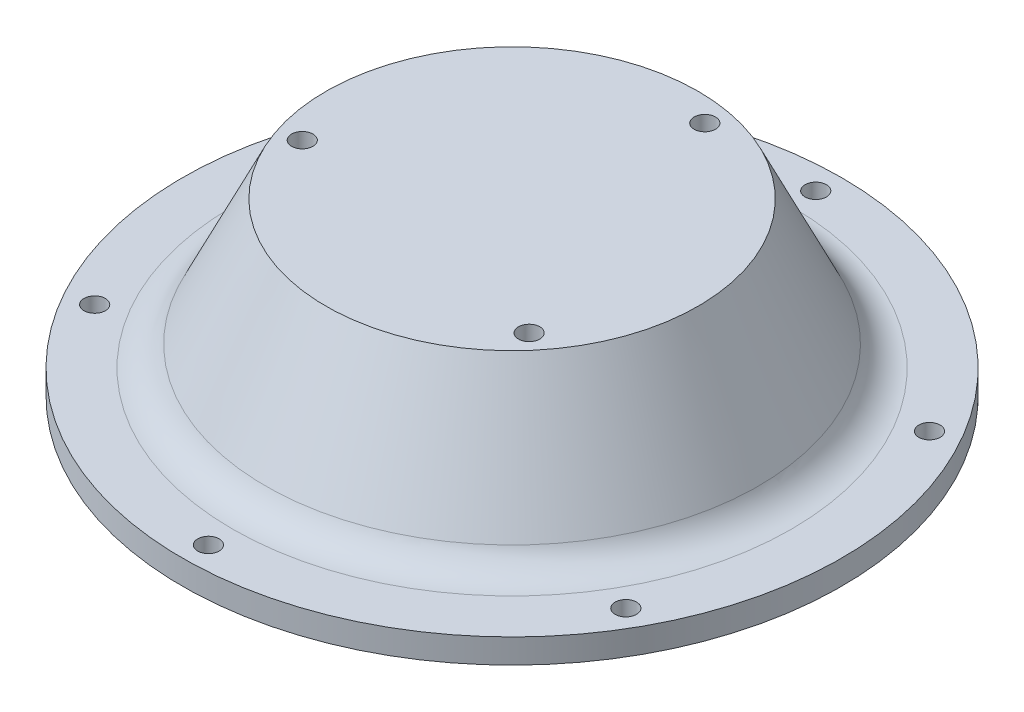
from build123d import *

# Parameters (mm, degrees)
SKETCH4_R           = 54
BOSS_EXTRUDE1_DEPTH = 4
FILLET1_R           = 6
SKETCH9_R           = 1.75
CUT_EXTRUDE2_DEPTH  = 50
SKETCH7_R           = 1.75
CUT_EXTRUDE3_DEPTH  = 50


with BuildPart() as part:
    # Sketch2 → Revolve2 (revolve)
    with BuildSketch(Plane.XY, mode=Mode.PRIVATE) as revolve2_sk:
        Polygon((0, 0), (42, 0), (42, 24), (11.5, 24), align=None)
    revolve(revolve2_sk.sketch.rotate(Axis((42, 0, 0), (0, 1, 0)), 270), axis=Axis((42, 0, 0), (0, 1, 0)))

    # Sketch4 → Boss-Extrude1 (add)
    with BuildSketch(Plane.XZ):
        with Locations(Location((42, 0, 0), (0, 0, 270))):
            Circle(SKETCH4_R)
    extrude(amount=BOSS_EXTRUDE1_DEPTH)

    # Fillet1
    fillet1_edges = [part.edges().sort_by_distance(p)[0] for p in [
        (42, 0, 42),
    ]]
    fillet(fillet1_edges, radius=FILLET1_R)

    # Sketch9 → Cut-Extrude2 (cut)
    with BuildSketch(Plane(origin=(0, 24, 0), x_dir=(1, 0, 0), z_dir=(0, 1, 0))):
        with Locations(Location((47.059526539, 26.521711694, 0), (0, 0, 270))):
            Circle(SKETCH9_R)
        with Locations(Location((62.43871281, -17.642534361, 0), (0, 0, 270))):
            Circle(SKETCH9_R)
        with Locations(Location((16.501760651, -8.879177334, 0), (0, 0, 270))):
            Circle(SKETCH9_R)
    extrude(amount=-CUT_EXTRUDE2_DEPTH, mode=Mode.SUBTRACT)

    # Sketch7 → Cut-Extrude3 (cut)
    with BuildSketch(Plane(origin=(0, 0, 0), x_dir=(1, 0, 0), z_dir=(0, 1, 0))):
        with Locations(Location((42.246934907, -49.999390228, 0), (0, 0, 270))):
            Circle(SKETCH7_R)
        with Locations(Location((-1.177274657, -25.213547017, 0), (0, 0, 270))):
            Circle(SKETCH7_R)
        with Locations(Location((-1.424209565, 24.785843211, 0), (0, 0, 270))):
            Circle(SKETCH7_R)
        with Locations(Location((41.753065093, 49.999390228, 0), (0, 0, 270))):
            Circle(SKETCH7_R)
        with Locations(Location((85.177274657, 25.213547017, 0), (0, 0, 270))):
            Circle(SKETCH7_R)
        with Locations(Location((85.424209565, -24.785843211, 0), (0, 0, 270))):
            Circle(SKETCH7_R)
    extrude(amount=-CUT_EXTRUDE3_DEPTH, mode=Mode.SUBTRACT)


solid = part.part
